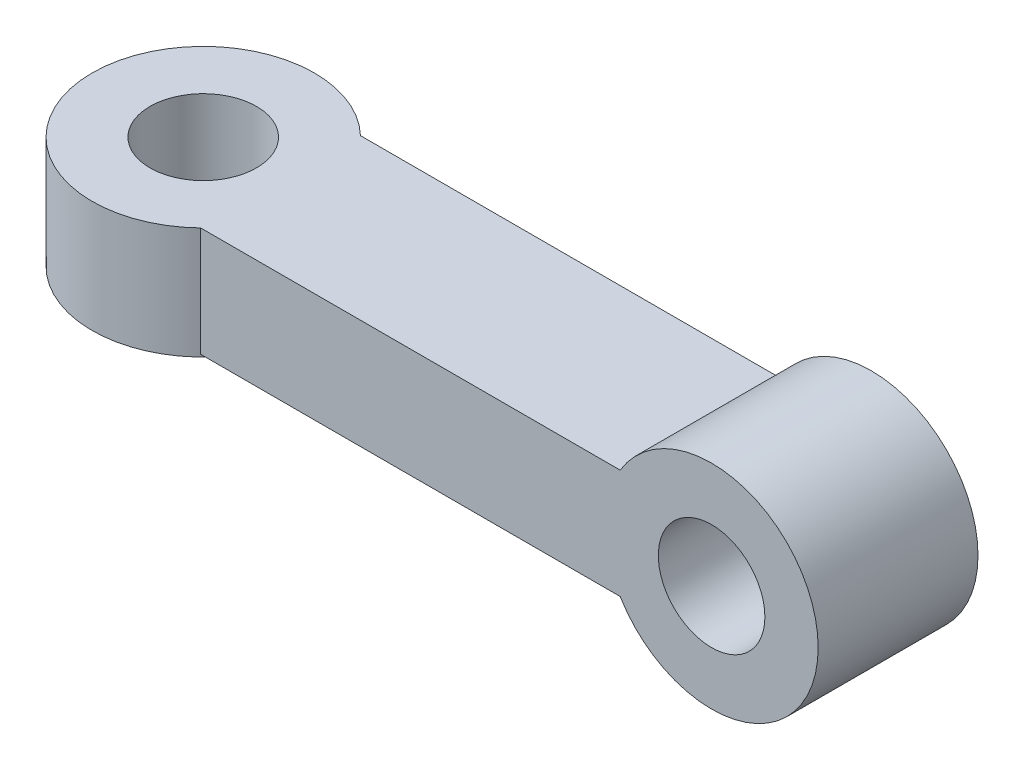
from build123d import *

# Parameters (mm, degrees)
SKETCH4_R           = 5
BOSS_EXTRUDE6_DEPTH = 15
SKETCH9_R           = 10.43494917
SKETCH9_R_2         = 5
BOSS_EXTRUDE8_DEPTH = 10.5


with BuildPart() as part:
    # Sketch4 → Boss-Extrude6 (new body)
    with BuildSketch(Plane.XY):
        with BuildLine():
            Line((101.689180826, -7.145205758), (62.319180826, -7.145205758))
            Line((62.319180826, -7.145205758), (62.319180826, 3.125413503))
            Line((62.319180826, 3.125413503), (101.689180826, 3.125413503))
            ThreePointArc((101.689180826, 3.125413503), (120.269891461, -2.009896128), (101.689180826, -7.145205758))
        make_face()
        with Locations((110.269891461, -2.009896128)):
            Circle(SKETCH4_R, mode=Mode.SUBTRACT)
    extrude(amount=BOSS_EXTRUDE6_DEPTH)

    # Sketch9 → Boss-Extrude8 (add)
    with BuildSketch(Plane(origin=(0, 3.125413503, 0), x_dir=(1, 0, 0), z_dir=(0, 1, 0))):
        with Locations(Location((55.063964483, -7.5, 0), (0, 0, 180))):
            Circle(SKETCH9_R)
        with Locations(Location((55.063964483, -7.5, 0), (0, 0, 180))):
            Circle(SKETCH9_R_2, mode=Mode.SUBTRACT)
    extrude(amount=-BOSS_EXTRUDE8_DEPTH)


solid = part.part
